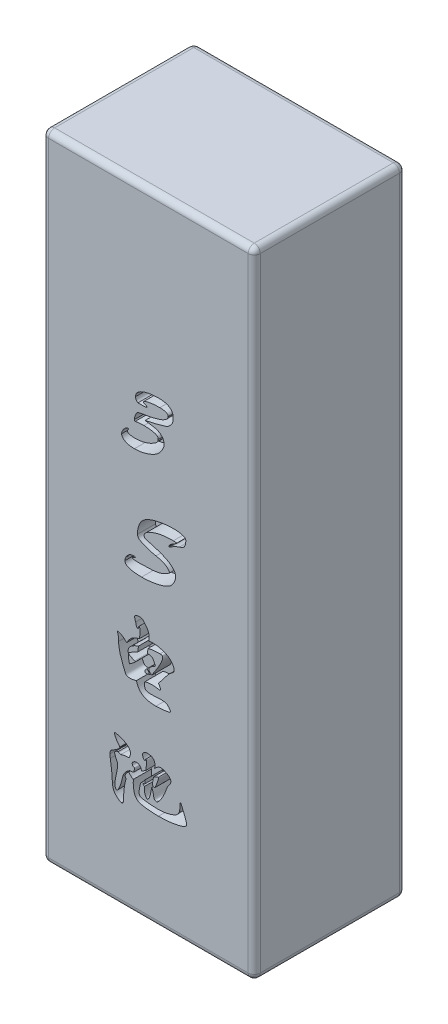
from build123d import *

# Parameters (mm, degrees)
SKETCH_1_W          = 35
SKETCH_1_H          = 25
EXTRUDE_1_DEPTH     = 105
CUT_EXTRUDE_1_DEPTH = 3
FILLET_1_R          = 1


with BuildPart() as part:
    # 草图1 → 凸台-拉伸1 (new body)
    with BuildSketch(Plane(origin=(0, 0, 0), x_dir=(1, 0, 0), z_dir=(0, 1, 0))):
        Rectangle(SKETCH_1_W, SKETCH_1_H)
    extrude(amount=EXTRUDE_1_DEPTH)

    # 草图2 → 切除-拉伸1 (cut)
    # profile 1 of 4: a face of its own
    with BuildSketch(Plane.XY.offset(12.5)):
        with BuildLine():
            add(Edge.make_bspline(
                [(-1.730306457, 73.513618816), (-1.791180014, 73.548812902), (-1.909380951, 73.61715085), (-2.039109334, 73.779414632), (-2.117631226, 73.977221056), (-2.125929828, 74.121433221), (-2.130306457, 74.197489784)],
                knots=[0, 0, 0, 0, 0.999955246, 1.941658306, 2.91444391, 4, 4, 4, 4], degree=3))
            add(Edge.make_bspline(
                [(-2.130306457, 74.197489784), (-2.127029901, 74.261627679), (-2.12051476, 74.38916019), (-2.067064093, 74.574231653), (-1.978296008, 74.747588152), (-1.85611176, 74.91048108), (-1.697984979, 75.060540823), (-1.509840803, 75.204572652), (-1.282995023, 75.331386124), (-1.027155916, 75.450909946), (-0.744482998, 75.555860885), (-0.443740206, 75.652201463), (-0.123735095, 75.726810348), (0.211255109, 75.79589898), (0.564269732, 75.842893121), (0.93353438, 75.880416215), (1.320332552, 75.901882804), (1.584363695, 75.9039575), (1.719155909, 75.905016666)],
                knots=[0, 0, 0, 0, 0.672198839, 1.336607732, 2.002717842, 2.706822371, 3.462221912, 4.28368772, 5.186885133, 6.18303703, 7.244851317, 8.348784579, 9.494572634, 10.691023334, 11.936781137, 13.229464089, 14.585596135, 16, 16, 16, 16], degree=3))
            add(Edge.make_bspline(
                [(1.719155909, 75.905016666), (1.815234647, 75.903761521), (2.001863562, 75.901323454), (2.272789741, 75.883047144), (2.525120829, 75.847159687), (2.759492676, 75.804679611), (2.974170874, 75.743283203), (3.170791952, 75.670566204), (3.349920224, 75.585067253), (3.510343267, 75.485940782), (3.651520922, 75.373641261), (3.773777431, 75.247179499), (3.877343975, 75.106997129), (3.96200843, 74.952937206), (4.026164985, 74.785499806), (4.073787162, 74.606138724), (4.102113975, 74.413446913), (4.1048478, 74.280740118), (4.106252683, 74.212543548)],
                knots=[0, 0, 0, 0, 1.385406795, 2.691094532, 3.911693398, 5.05906555, 6.122496103, 7.126604688, 8.078944564, 8.979565011, 9.839962201, 10.673298656, 11.508492024, 12.345793421, 13.199959379, 14.087495055, 15.017184635, 16, 16, 16, 16], degree=3))
            add(Edge.make_bspline(
                [(4.106252683, 74.212543548), (4.105291045, 74.150103238), (4.103416863, 74.028410351), (4.080935158, 73.852250541), (4.047498207, 73.686987867), (3.99754602, 73.533702772), (3.934112316, 73.390047516), (3.85873732, 73.253363423), (3.767784549, 73.123721718), (3.630268481, 72.965495472), (3.445329242, 72.793349144), (3.270333093, 72.651627664), (3.136743574, 72.573194525), (3.046596154, 72.532444852), (2.936832484, 72.48295041), (2.802697012, 72.43921244), (2.650060064, 72.382609116), (2.47402615, 72.329247462), (2.27768665, 72.267123926), (2.05830056, 72.206518885), (1.816660542, 72.138135381), (1.550709568, 72.071262811), (1.261683426, 71.996535214), (0.947265937, 71.922274552), (0.608163031, 71.842866372), (0.244972483, 71.758589476), (-0.142164911, 71.672683793), (-0.408400428, 71.615931983), (-0.54536022, 71.586737096)],
                knots=[0, 0, 0, 0, 0.836456046, 1.630208961, 2.376479833, 3.093602454, 3.786297661, 4.478792908, 5.182529622, 5.904783775, 7.284464382, 8.566320335, 8.910763354, 9.357749901, 9.891445239, 10.523579676, 11.246855767, 12.07342966, 12.988279315, 14.007212142, 15.123851981, 16.35436935, 17.682738842, 19.125360386, 20.684611252, 22.351164436, 24.122926027, 26, 26, 26, 26], degree=3))
            add(Edge.make_bspline(
                [(-0.54536022, 71.586737096), (-0.389667257, 71.571444628), (-0.09200559, 71.542207716), (0.331833401, 71.481612461), (0.713539777, 71.413191994), (1.053142566, 71.338038735), (1.350656799, 71.249559831), (1.606114408, 71.152813202), (1.820220296, 71.045604006), (1.994692263, 70.927541914), (2.135446583, 70.79952484), (2.257661804, 70.669792623), (2.361722104, 70.534205129), (2.446617341, 70.39140508), (2.510703762, 70.242032793), (2.559169906, 70.08813705), (2.587797441, 69.928311807), (2.590775559, 69.819824157), (2.592274188, 69.76523172)],
                knots=[0, 0, 0, 0, 1.875842043, 3.586329504, 5.132537692, 6.525559935, 7.754858419, 8.851583743, 9.797331124, 10.619928457, 11.36879248, 12.074316378, 12.755161505, 13.414166241, 14.060947262, 14.69991191, 15.345778268, 16, 16, 16, 16], degree=3))
            add(Edge.make_bspline(
                [(2.592274188, 69.76523172), (2.590780273, 69.709907826), (2.587754232, 69.597845017), (2.557266705, 69.4288221), (2.512485918, 69.255827586), (2.447480436, 69.079458475), (2.362736264, 68.90103531), (2.260675736, 68.719736543), (2.141843932, 68.534266572), (2.005896713, 68.345981103), (1.848976807, 68.161462408), (1.672326326, 67.983254436), (1.47084072, 67.819000149), (1.250126738, 67.661286235), (1.009929005, 67.511187901), (0.748160638, 67.370135946), (0.463517544, 67.24338575), (0.063023974, 67.080167636), (-0.452898853, 66.913623784), (-1.075359586, 66.765598195), (-1.694754731, 66.676473311), (-2.106374758, 66.663935955), (-2.310951618, 66.657704838)],
                knots=[0, 0, 0, 0, 0.523865779, 1.061130489, 1.623088537, 2.216335527, 2.83941307, 3.493396601, 4.186980173, 4.926278888, 5.69270977, 6.480613127, 7.300951587, 8.153167955, 9.050528849, 9.9837488, 10.968897468, 12.002210523, 14.08204034, 16.099212387, 18.061292385, 20, 20, 20, 20], degree=3))
            add(Edge.make_bspline(
                [(-2.310951618, 66.657704838), (-2.391268483, 66.658272517), (-2.547752948, 66.659378547), (-2.775157627, 66.675352732), (-2.989243287, 66.697964516), (-3.19036557, 66.732491794), (-3.378489983, 66.777303087), (-3.553236016, 66.830737482), (-3.714537856, 66.893465689), (-3.861245569, 66.965578528), (-3.99357117, 67.045617519), (-4.109417081, 67.13054801), (-4.207694193, 67.220861257), (-4.285903352, 67.317335185), (-4.349394311, 67.416322313), (-4.395618318, 67.520429801), (-4.42230651, 67.630561234), (-4.425471806, 67.705590669), (-4.42708065, 67.743726343)],
                knots=[0, 0, 0, 0, 1.478588714, 2.880791784, 4.195591928, 5.441187609, 6.63536673, 7.754298844, 8.803395663, 9.818734309, 10.7604483, 11.647475829, 12.45997408, 13.210379233, 13.928150046, 14.61971234, 15.298432668, 16, 16, 16, 16], degree=3))
            add(Edge.make_bspline(
                [(-4.42708065, 67.743726343), (-4.422003475, 67.810211763), (-4.411381293, 67.949308823), (-4.336154657, 68.158477442), (-4.219783029, 68.375999084), (-4.063733443, 68.588882517), (-3.896510857, 68.784305366), (-3.728346232, 68.928711013), (-3.574296981, 69.031574022), (-3.466887056, 69.045139433), (-3.4184785, 69.051253225)],
                knots=[0, 0, 0, 0, 0.911131539, 1.90621821, 3.019149988, 4.288022676, 5.521145276, 6.532282378, 7.338514662, 8, 8, 8, 8], degree=3))
            add(Edge.make_bspline(
                [(-3.4184785, 69.051253225), (-3.403256859, 69.050209943), (-3.374862659, 69.048263823), (-3.335861367, 69.028494014), (-3.316091558, 68.989492722), (-3.314145438, 68.961098522), (-3.313102156, 68.945876881)],
                knots=[0, 0, 0, 0, 1.072165494, 2, 2.927834506, 4, 4, 4, 4], degree=3))
            add(Edge.make_bspline(
                [(-3.313102156, 68.945876881), (-3.317793769, 68.919304062), (-3.328517105, 68.85856818), (-3.366823932, 68.809843151), (-3.388370973, 68.782436021)],
                knots=[0, 0, 0, 0, 0.875028685, 2, 2, 2, 2], degree=3))
            add(Edge.make_bspline(
                [(-3.388370973, 68.782436021), (-3.409959904, 68.755773217), (-3.449087646, 68.707449598), (-3.45913577, 68.646372609), (-3.46363979, 68.618995161)],
                knots=[0, 0, 0, 0, 1.103510232, 2, 2, 2, 2], degree=3))
            add(Edge.make_bspline(
                [(-3.46363979, 68.618995161), (-3.459091625, 68.589163433), (-3.449374206, 68.525426208), (-3.372327749, 68.444529424), (-3.260361092, 68.376118538), (-3.107886891, 68.315283188), (-2.920364443, 68.265165764), (-2.699742906, 68.23065659), (-2.449866021, 68.205790437), (-2.273032108, 68.204579862), (-2.179768822, 68.203941397)],
                knots=[0, 0, 0, 0, 0.495429141, 1.058513229, 1.788424836, 2.698863852, 3.794884536, 5.0374145, 6.437514308, 8, 8, 8, 8], degree=3))
            add(Edge.make_bspline(
                [(-2.179768822, 68.203941397), (-2.067164163, 68.205413357), (-1.842320667, 68.208352493), (-1.507817057, 68.237649482), (-1.177664346, 68.282777275), (-0.852067666, 68.344464278), (-0.530972311, 68.427669204), (-0.212845078, 68.525024835), (0.099371447, 68.644984105), (0.402288795, 68.777052128), (0.682296817, 68.921826572), (0.934057633, 69.063464966), (1.144671705, 69.210105376), (1.320406369, 69.353276109), (1.455343001, 69.499711624), (1.553398214, 69.646207567), (1.616500957, 69.794049905), (1.624832276, 69.895166079), (1.628833328, 69.943726343)],
                knots=[0, 0, 0, 0, 1.218753128, 2.433546845, 3.631995342, 4.825206456, 6.018493273, 7.221205386, 8.424668334, 9.637303694, 10.796492467, 11.836046134, 12.761696787, 13.57148077, 14.285591581, 14.907622181, 15.475393964, 16, 16, 16, 16], degree=3))
            add(Edge.make_bspline(
                [(1.628833328, 69.943726343), (1.626486935, 69.979718629), (1.621908444, 70.049949974), (1.594049447, 70.151930252), (1.542030698, 70.243683559), (1.473234545, 70.328633579), (1.381798167, 70.401936314), (1.273187608, 70.468369742), (1.146156607, 70.529175112), (0.998738173, 70.57674731), (0.835426824, 70.618946198), (0.65628536, 70.658282496), (0.461659772, 70.68972408), (0.251370177, 70.715061069), (0.026987292, 70.736817327), (-0.213291269, 70.751575952), (-0.468591019, 70.76025184), (-0.644277752, 70.760700146), (-0.734607532, 70.760930644)],
                knots=[0, 0, 0, 0, 0.637672052, 1.24428237, 1.851953661, 2.492146166, 3.168067819, 3.914632588, 4.743387679, 5.654342341, 6.651629748, 7.729396191, 8.899782899, 10.140110992, 11.478605832, 12.890010473, 14.400990979, 16, 16, 16, 16], degree=3))
            add(Edge.make_bspline(
                [(-0.734607532, 70.760930644), (-0.876600867, 70.759633026), (-1.147988868, 70.757152925), (-1.535687891, 70.728968387), (-1.885259597, 70.684173928), (-2.102628285, 70.635565), (-2.205575274, 70.612543548)],
                knots=[0, 0, 0, 0, 1.14957966, 2.197160359, 3.146165375, 4, 4, 4, 4], degree=3))
            add(Edge.make_bspline(
                [(-2.205575274, 70.612543548), (-2.221537499, 70.615950054), (-2.255411473, 70.623179115), (-2.29274014, 70.67329526), (-2.307855197, 70.746997569), (-2.309829089, 70.80386158), (-2.310951618, 70.836199462)],
                knots=[0, 0, 0, 0, 0.701166991, 1.487969987, 2.571438647, 4, 4, 4, 4], degree=3))
            add(Edge.make_bspline(
                [(-2.310951618, 70.836199462), (-2.308679759, 70.892249801), (-2.30389905, 71.010197385), (-2.269233978, 71.191421986), (-2.217301135, 71.385956611), (-2.144324169, 71.582637428), (-2.061438846, 71.768762803), (-1.967597585, 71.922649117), (-1.869433391, 72.040473451), (-1.749120502, 72.120718391), (-1.591567652, 72.174180551), (-1.380138812, 72.224930696), (-1.102856018, 72.283727704), (-0.894655016, 72.316848176), (-0.779768822, 72.335124193)],
                knots=[0, 0, 0, 0, 0.826634098, 1.739498749, 2.714400975, 3.795086418, 4.831442747, 5.714853365, 6.449116581, 7.073916504, 7.820342101, 8.889999852, 10.283888761, 12, 12, 12, 12], degree=3))
            add(Edge.make_bspline(
                [(-0.779768822, 72.335124193), (-0.601859733, 72.363004726), (-0.259062524, 72.416725247), (0.234270357, 72.507138009), (0.687282583, 72.60176827), (1.100885021, 72.697153171), (1.472908848, 72.7985009), (1.805080828, 72.900367973), (2.096833216, 73.007490154), (2.350165788, 73.119482517), (2.568412753, 73.234432733), (2.757553952, 73.347093775), (2.915330498, 73.464676896), (3.047797543, 73.579092561), (3.151222603, 73.695612685), (3.224447782, 73.813929213), (3.270702679, 73.933974648), (3.277257426, 74.015764509), (3.280446231, 74.0555543)],
                knots=[0, 0, 0, 0, 1.872580607, 3.608109113, 5.214819709, 6.684847228, 8.021201173, 9.223647564, 10.296794887, 11.251218765, 12.101476762, 12.86087382, 13.537747157, 14.145039752, 14.678692822, 15.150444373, 15.586701329, 16, 16, 16, 16], degree=3))
            add(Edge.make_bspline(
                [(3.280446231, 74.0555543), (3.275563692, 74.098709683), (3.265686049, 74.186015378), (3.19162864, 74.307571349), (3.069226501, 74.405163474), (2.90695767, 74.487744547), (2.70567631, 74.555490268), (2.465212248, 74.60374734), (2.186390598, 74.629724601), (1.988026337, 74.633952405), (1.882596769, 74.636199462)],
                knots=[0, 0, 0, 0, 0.628077383, 1.270634851, 2.012989815, 2.888371059, 3.917623474, 5.103918923, 6.460748047, 8, 8, 8, 8], degree=3))
            add(Edge.make_bspline(
                [(1.882596769, 74.636199462), (1.705482879, 74.634289546), (1.363128614, 74.630597753), (0.867883768, 74.59805216), (0.409686294, 74.545672988), (0.055200015, 74.482664691), (-0.200479054, 74.423740469), (-0.363525371, 74.381589217), (-0.50218794, 74.338687376), (-0.615834751, 74.296457929), (-0.70649058, 74.255010235), (-0.768836615, 74.210210521), (-0.813139217, 74.165992672), (-0.819768704, 74.131455071), (-0.822779575, 74.115769354)],
                knots=[0, 0, 0, 0, 2.261010845, 4.3704461, 6.333206645, 8.146368439, 8.963362016, 9.682596285, 10.296259202, 10.814702885, 11.232199318, 11.559887471, 11.800116973, 12, 12, 12, 12], degree=3))
            add(Edge.make_bspline(
                [(-0.822779575, 74.115769354), (-0.818084736, 74.086793577), (-0.808253838, 74.026118882), (-0.750272499, 73.961426887), (-0.678644188, 73.916398414), (-0.592609311, 73.879634418), (-0.480752058, 73.833415994), (-0.395056587, 73.804777135), (-0.347510758, 73.788887634)],
                knots=[0, 0, 0, 0, 0.849706339, 1.779268026, 2.43487114, 3.34138727, 4.524940175, 6, 6, 6, 6], degree=3))
            add(Edge.make_bspline(
                [(-0.347510758, 73.788887634), (-0.331797035, 73.786678622), (-0.297439357, 73.781848671), (-0.258623366, 73.743561534), (-0.221065371, 73.703317607), (-0.216350146, 73.66767632), (-0.214177425, 73.651253225)],
                knots=[0, 0, 0, 0, 0.89795082, 1.963347926, 3.061534127, 4, 4, 4, 4], degree=3))
            add(Edge.make_bspline(
                [(-0.214177425, 73.651253225), (-0.221037085, 73.63791114), (-0.240040758, 73.600948866), (-0.325273451, 73.580244655), (-0.440767689, 73.556318182), (-0.608588135, 73.539125412), (-0.821693345, 73.524500263), (-1.082954908, 73.514067257), (-1.391215017, 73.510190234), (-1.612021586, 73.512422828), (-1.730306457, 73.513618816)],
                knots=[0, 0, 0, 0, 0.225272153, 0.62408317, 1.248098043, 2.11058556, 3.214749851, 4.573187907, 6.164275508, 8, 8, 8, 8], degree=3))
        make_face()
    # profile 2 of 4: a face of its own
    with BuildSketch(Plane.XY.offset(12.5)):
        with BuildLine():
            add(Edge.make_bspline(
                [(3.555715048, 51.813618816), (3.507301888, 51.893539111), (3.409344397, 52.055247032), (3.212970439, 52.26896207), (2.979890167, 52.461270995), (2.709513095, 52.634009864), (2.398950786, 52.781688835), (2.050509994, 52.907022281), (1.665005718, 53.016184842), (1.392083358, 53.065451233), (1.250338704, 53.091038171)],
                knots=[0, 0, 0, 0, 0.820907435, 1.660995296, 2.539275621, 3.475815558, 4.477785669, 5.559859216, 6.732691188, 8, 8, 8, 8], degree=3))
            add(Edge.make_bspline(
                [(1.250338704, 53.091038171), (1.085016281, 53.121973365), (0.759510197, 53.182882184), (0.286542241, 53.307852063), (-0.166383531, 53.448430165), (-0.525347023, 53.584933421), (-0.792858583, 53.700462106), (-0.971665264, 53.781662943), (-1.129703053, 53.860036875), (-1.268655903, 53.93206848), (-1.388391068, 53.999783235), (-1.484399711, 54.067543197), (-1.564348095, 54.126656827), (-1.6393694, 54.202306471), (-1.708504267, 54.297437593), (-1.766010846, 54.414240206), (-1.806855032, 54.532084922), (-1.810317237, 54.612579801), (-1.812026887, 54.652328494)],
                knots=[0, 0, 0, 0, 2.231390021, 4.393421135, 6.487556548, 8.522957162, 9.486057926, 10.354481635, 11.128807778, 11.826658411, 12.432006073, 12.951853481, 13.385726504, 13.74897995, 14.361683441, 14.93603757, 15.474611091, 16, 16, 16, 16], degree=3))
            add(Edge.make_bspline(
                [(-1.812026887, 54.652328494), (-1.810243389, 54.7412714), (-1.806698957, 54.918031952), (-1.782378603, 55.179416399), (-1.744540304, 55.434709562), (-1.687688738, 55.682259543), (-1.617314992, 55.924088127), (-1.529082224, 56.158254538), (-1.424019461, 56.385123284), (-1.308276188, 56.608830624), (-1.162281562, 56.822015334), (-0.984679372, 57.02359926), (-0.771195512, 57.210117294), (-0.527126624, 57.387595103), (-0.248253614, 57.549868439), (0.062994794, 57.700850768), (0.408068226, 57.837043601), (0.781659023, 57.962152115), (1.175490644, 58.075331558), (1.582916023, 58.170920442), (1.997282466, 58.255083691), (2.420317194, 58.325078477), (2.851861851, 58.374535355), (3.291977399, 58.41515907), (3.740471435, 58.43541594), (4.042438285, 58.439513443), (4.194424726, 58.441575806)],
                knots=[0, 0, 0, 0, 0.796097096, 1.582122374, 2.348063635, 3.104620427, 3.853848825, 4.601123703, 5.341951547, 6.091207422, 6.852971061, 7.648576651, 8.489471317, 9.385367846, 10.346110912, 11.37352057, 12.479297411, 13.664339857, 14.899202987, 16.145880082, 17.409354384, 18.683699227, 19.982637736, 21.296750779, 22.639396249, 24, 24, 24, 24], degree=3))
            add(Edge.make_bspline(
                [(4.194424726, 58.441575806), (4.316333951, 58.440726573), (4.547462998, 58.439116503), (4.873947399, 58.4169734), (5.161731347, 58.385125524), (5.409017964, 58.334731828), (5.617770951, 58.279324478), (5.789279655, 58.222066498), (5.924070873, 58.163054321), (6.027423205, 58.100191886), (6.100360721, 58.024938589), (6.151691015, 57.93910044), (6.179425525, 57.83819173), (6.183614135, 57.767185708), (6.185822575, 57.729747849)],
                knots=[0, 0, 0, 0, 1.907925139, 3.617256357, 5.120455527, 6.43646588, 7.563359051, 8.500189904, 9.263571122, 9.864306058, 10.380121743, 10.888189608, 11.413798988, 12, 12, 12, 12], degree=3))
            add(Edge.make_bspline(
                [(6.185822575, 57.729747849), (6.184216279, 57.657977184), (6.18113879, 57.520472355), (6.15657365, 57.322733368), (6.12026452, 57.141696789), (6.0629866, 56.981448765), (6.000329655, 56.841583604), (5.928809299, 56.725863742), (5.852308626, 56.632812776), (5.760545618, 56.563526497), (5.647381387, 56.506165462), (5.505787947, 56.439244487), (5.32459611, 56.364812951), (5.190273016, 56.314293402), (5.117005371, 56.286737096)],
                knots=[0, 0, 0, 0, 1.300752096, 2.492100301, 3.608643568, 4.640340446, 5.570793169, 6.382255368, 7.101220932, 7.740727149, 8.450232227, 9.397953669, 10.580692263, 12, 12, 12, 12], degree=3))
            add(Edge.make_bspline(
                [(5.117005371, 56.286737096), (5.047325762, 56.263494819), (4.916754417, 56.21994154), (4.737046632, 56.153217647), (4.58511638, 56.093688248), (4.452383889, 56.033252038), (4.316978159, 55.962532039), (4.157535611, 55.871787477), (3.96536402, 55.752585307), (3.825229649, 55.665259059), (3.749263436, 55.617919892)],
                knots=[0, 0, 0, 0, 1.153225154, 2.161007542, 3.0095779, 3.714726508, 4.449696184, 5.407397547, 6.594561858, 8, 8, 8, 8], degree=3))
            add(Edge.make_bspline(
                [(3.749263436, 55.617919892), (3.717119685, 55.597661772), (3.65834575, 55.560620375), (3.576303661, 55.512464223), (3.508742599, 55.47795174), (3.467638222, 55.461431762), (3.450338704, 55.454479031)],
                knots=[0, 0, 0, 0, 1.335970956, 2.442785003, 3.344618021, 4, 4, 4, 4], degree=3))
            add(Edge.make_bspline(
                [(3.450338704, 55.454479031), (3.429601097, 55.456282207), (3.390613443, 55.459672261), (3.381490743, 55.497150564), (3.377220425, 55.514694085)],
                knots=[0, 0, 0, 0, 1.063803838, 2, 2, 2, 2], degree=3))
            add(Edge.make_bspline(
                [(3.377220425, 55.514694085), (3.380798867, 55.539550343), (3.388943457, 55.596123573), (3.44124217, 55.680204372), (3.51479779, 55.777421538), (3.617515495, 55.885547301), (3.747999541, 55.997277742), (3.901417155, 56.110940551), (4.075755429, 56.225954773), (4.20318463, 56.295566206), (4.269693543, 56.331898386)],
                knots=[0, 0, 0, 0, 0.481016015, 1.094799946, 1.876333894, 2.846811501, 3.966565452, 5.194289722, 6.535620247, 8, 8, 8, 8], degree=3))
            add(Edge.make_bspline(
                [(4.269693543, 56.331898386), (4.328131453, 56.363813996), (4.430158358, 56.419535546), (4.556010624, 56.494645783), (4.639689547, 56.55325945), (4.661895463, 56.597931334), (4.669693543, 56.613618816)],
                knots=[0, 0, 0, 0, 1.606940928, 2.805562504, 3.580547871, 4, 4, 4, 4], degree=3))
            add(Edge.make_bspline(
                [(4.669693543, 56.613618816), (4.66736021, 56.619822221), (4.661402691, 56.635660895), (4.630003908, 56.648436454), (4.587584517, 56.661016939), (4.526457735, 56.670958409), (4.449822331, 56.678989154), (4.355816253, 56.686065835), (4.244597032, 56.686487598), (4.164314192, 56.688050424), (4.121306446, 56.688887634)],
                knots=[0, 0, 0, 0, 0.271548451, 0.693323603, 1.327259845, 2.190788188, 3.2904756, 4.599130666, 6.178144631, 8, 8, 8, 8], degree=3))
            add(Edge.make_bspline(
                [(4.121306446, 56.688887634), (3.959275892, 56.687071744), (3.64077604, 56.683502291), (3.171525248, 56.660265972), (2.719758185, 56.618596768), (2.284402701, 56.564896625), (1.86752981, 56.487463437), (1.466439133, 56.401088271), (1.083000191, 56.295670649), (0.72246195, 56.174287521), (0.391710187, 56.04552974), (0.101394773, 55.910746321), (-0.146462107, 55.774723881), (-0.348091409, 55.632301505), (-0.509501381, 55.489162927), (-0.624049323, 55.339352996), (-0.698393869, 55.184170328), (-0.706838618, 55.076709915), (-0.710951618, 55.024371505)],
                knots=[0, 0, 0, 0, 1.443500069, 2.837455931, 4.184029143, 5.484677003, 6.743594713, 7.959937656, 9.13895992, 10.284008972, 11.34776136, 12.299150409, 13.134054904, 13.862330128, 14.495108856, 15.046875272, 15.535782229, 16, 16, 16, 16], degree=3))
            add(Edge.make_bspline(
                [(-0.710951618, 55.024371505), (-0.706275841, 54.984181745), (-0.696586375, 54.900897768), (-0.633604013, 54.790231052), (-0.550208489, 54.697411823), (-0.476539185, 54.666680517), (-0.442134414, 54.652328494)],
                knots=[0, 0, 0, 0, 0.989554999, 2.050623775, 3.089609401, 4, 4, 4, 4], degree=3))
            Line((-0.442134414, 54.652328494), (1.222381715, 54.162005913))
            add(Edge.make_bspline(
                [(1.222381715, 54.162005913), (1.358088417, 54.121164272), (1.623604817, 54.041255723), (2.010782291, 53.911163222), (2.374664714, 53.765805171), (2.718136372, 53.617887678), (3.031011099, 53.460759868), (3.314485748, 53.308076501), (3.560645339, 53.150778776), (3.772229146, 52.992766575), (3.955129313, 52.838627102), (4.106683192, 52.682131675), (4.232772133, 52.528822505), (4.329691133, 52.372963014), (4.400698169, 52.216227227), (4.454574205, 52.056725827), (4.484257153, 51.891428038), (4.488886006, 51.779315732), (4.491198919, 51.723296236)],
                knots=[0, 0, 0, 0, 1.569926476, 3.071633303, 4.522661867, 5.909494893, 7.212832509, 8.399869998, 9.474839758, 10.445233056, 11.323779984, 12.121206503, 12.855393202, 13.518691094, 14.147634979, 14.757851845, 15.379332052, 16, 16, 16, 16], degree=3))
            add(Edge.make_bspline(
                [(4.491198919, 51.723296236), (4.484658024, 51.614374431), (4.471159972, 51.389599051), (4.366157205, 51.052452363), (4.2038508, 50.707168569), (4.020217489, 50.418765894), (3.83423808, 50.189619353), (3.657415583, 50.025299461), (3.4488934, 49.873515398), (3.211316044, 49.728612644), (2.941561198, 49.59639641), (2.640787739, 49.474230156), (2.3099067, 49.360471366), (1.827014105, 49.224676821), (1.199099008, 49.08299408), (0.430465074, 48.961107526), (-0.346561641, 48.881901562), (-0.868467101, 48.873665045), (-1.130306457, 48.869532795)],
                knots=[0, 0, 0, 0, 0.752754734, 1.553414692, 2.42340864, 3.389424232, 3.910889496, 4.461886233, 5.054208856, 5.693140428, 6.385315681, 7.130579478, 7.938506143, 8.805255288, 10.600794157, 12.389302065, 14.188517088, 16, 16, 16, 16], degree=3))
            add(Edge.make_bspline(
                [(-1.130306457, 48.869532795), (-1.234972894, 48.870518736), (-1.438626249, 48.872437118), (-1.735575094, 48.882653363), (-2.01531501, 48.901880687), (-2.277974821, 48.929236679), (-2.523100212, 48.966458936), (-2.75109762, 49.007759011), (-2.96087313, 49.060851145), (-3.153658417, 49.116473537), (-3.325836279, 49.1836848), (-3.476742492, 49.254900846), (-3.603614333, 49.335500547), (-3.708298039, 49.421650162), (-3.792038362, 49.514271573), (-3.851542099, 49.615012244), (-3.888228507, 49.722955749), (-3.891899534, 49.797568467), (-3.893747317, 49.835124193)],
                knots=[0, 0, 0, 0, 1.596291473, 3.105963309, 4.530587204, 5.871900175, 7.131983815, 8.311273364, 9.403700874, 10.430946621, 11.368912419, 12.219681164, 12.971800659, 13.654883692, 14.282240274, 14.86536268, 15.428889215, 16, 16, 16, 16], degree=3))
            add(Edge.make_bspline(
                [(-3.893747317, 49.835124193), (-3.888539101, 49.911019899), (-3.877704829, 50.068900201), (-3.791281459, 50.304647345), (-3.653926483, 50.542471735), (-3.505346121, 50.737741267), (-3.365258695, 50.887400874), (-3.252453566, 50.987750602), (-3.13477822, 51.073662606), (-3.012269982, 51.141777995), (-2.885835814, 51.197002794), (-2.755179392, 51.235756957), (-2.619181369, 51.257277206), (-2.527511089, 51.261123256), (-2.480844091, 51.263081182)],
                knots=[0, 0, 0, 0, 1.245188875, 2.590275593, 4.07801453, 5.75113495, 6.609623385, 7.444252278, 8.229077228, 8.9992613, 9.743410647, 10.492765198, 11.232705257, 12, 12, 12, 12], degree=3))
            add(Edge.make_bspline(
                [(-2.480844091, 51.263081182), (-2.425845546, 51.263159459), (-2.331455761, 51.2632938), (-2.218354286, 51.246638032), (-2.135577303, 51.233186235), (-2.115812152, 51.199693035), (-2.108801081, 51.187812365)],
                knots=[0, 0, 0, 0, 1.662530897, 2.853274219, 3.593234739, 4, 4, 4, 4], degree=3))
            add(Edge.make_bspline(
                [(-2.108801081, 51.187812365), (-2.111975689, 51.181659671), (-2.121327759, 51.163534467), (-2.161677469, 51.148930836), (-2.215716762, 51.123859563), (-2.261148929, 51.108487268), (-2.287295704, 51.099640322)],
                knots=[0, 0, 0, 0, 0.400177156, 1.178880859, 2.376410993, 4, 4, 4, 4], degree=3))
            add(Edge.make_bspline(
                [(-2.287295704, 51.099640322), (-2.326186742, 51.084265875), (-2.396432737, 51.056496152), (-2.488208552, 51.014077602), (-2.560403935, 50.984546606), (-2.621075462, 50.95729407), (-2.678399189, 50.917618624), (-2.685777893, 50.869699865), (-2.689446242, 50.845876881)],
                knots=[0, 0, 0, 0, 1.510662587, 2.728597701, 3.65730654, 4.317824595, 5.163700428, 6, 6, 6, 6], degree=3))
            add(Edge.make_bspline(
                [(-2.689446242, 50.845876881), (-2.68400887, 50.833401481), (-2.669299204, 50.799651913), (-2.596202838, 50.776593154), (-2.49805759, 50.751017486), (-2.355599844, 50.730646219), (-2.175017105, 50.717863005), (-1.954105227, 50.703745899), (-1.693064154, 50.698806129), (-1.505936923, 50.697949317), (-1.405575274, 50.697489784)],
                knots=[0, 0, 0, 0, 0.239795111, 0.648715167, 1.282346052, 2.141396028, 3.242446976, 4.590162425, 6.171207263, 8, 8, 8, 8], degree=3))
            add(Edge.make_bspline(
                [(-1.405575274, 50.697489784), (-1.27152542, 50.698101176), (-1.012738228, 50.699281487), (-0.637783294, 50.702699915), (-0.290133347, 50.712134171), (0.03111357, 50.721687407), (0.325685577, 50.737639097), (0.593975914, 50.753470955), (0.834781435, 50.775598403), (1.116645058, 50.805639936), (1.439985858, 50.859059061), (1.805566201, 50.936195877), (2.145023348, 51.03629371), (2.46168095, 51.152275118), (2.75832137, 51.288883133), (3.038960884, 51.444729847), (3.306278587, 51.617888291), (3.472777942, 51.748538822), (3.555715048, 51.813618816)],
                knots=[0, 0, 0, 0, 1.237555253, 2.389136853, 3.461554972, 4.448169342, 5.355997217, 6.184920643, 6.92906814, 7.588266918, 8.801374579, 9.952746989, 11.035427716, 12.065603678, 13.063517212, 14.046974835, 15.027153848, 16, 16, 16, 16], degree=3))
        make_face()
    # profile 3 of 4: a face of its own
    with BuildSketch(Plane.XY.offset(12.5)):
        with BuildLine():
            add(Edge.make_bspline(
                [(0.09980107, 40.279210214), (0.144644114, 40.294147049), (0.247412693, 40.328378385), (0.431172267, 40.351367544), (0.658549769, 40.367732783), (0.932279017, 40.376041785), (1.250689974, 40.356184484), (1.610358571, 40.298479523), (2.00992794, 40.201056474), (2.363340184, 40.094341456), (2.653772635, 39.992029202), (2.863351919, 39.90661244), (3.056746424, 39.811475043), (3.236524874, 39.710991079), (3.399949247, 39.60095217), (3.548848799, 39.484708518), (3.683872467, 39.362106341), (3.835414778, 39.191000251), (3.995133388, 38.979965179), (4.138417447, 38.726398204), (4.229940287, 38.480318567), (4.242299715, 38.316431413), (4.248188167, 38.238349999)],
                knots=[0, 0, 0, 0, 0.553780623, 1.269120991, 2.163729509, 3.232830331, 4.480664985, 5.903029542, 7.503376039, 9.305785439, 10.234765888, 11.117780202, 11.960870582, 12.763595554, 13.533856831, 14.271233816, 14.980009463, 15.671230546, 16.952115016, 18.078508404, 19.084536065, 20, 20, 20, 20], degree=3))
            add(Edge.make_bspline(
                [(4.248188167, 38.238349999), (4.245583426, 38.19296852), (4.240621105, 38.106511763), (4.206288951, 37.983352718), (4.143380952, 37.877916326), (4.084055553, 37.824149438), (4.05463978, 37.797489784)],
                knots=[0, 0, 0, 0, 1.092064677, 2.080504456, 3.048241631, 4, 4, 4, 4], degree=3))
            add(Edge.make_bspline(
                [(4.05463978, 37.797489784), (3.970649976, 37.733276698), (3.807935778, 37.60887611), (3.584022666, 37.410407407), (3.379416433, 37.217426989), (3.222805361, 37.046152504), (3.09134937, 36.891610499), (2.970018543, 36.738011141), (2.819090762, 36.549646801), (2.642651122, 36.322621343), (2.438741172, 36.059071284), (2.208961678, 35.757193059), (1.95060225, 35.420330413), (1.770629608, 35.182542124), (1.676145156, 35.057704838)],
                knots=[0, 0, 0, 0, 1.044716322, 2.023938297, 2.956112171, 3.82364298, 4.316308196, 4.961480688, 5.758265085, 6.70229449, 7.803562713, 9.052159997, 10.452403401, 12, 12, 12, 12], degree=3))
            add(Edge.make_bspline(
                [(1.676145156, 35.057704838), (1.7219572, 34.981381283), (1.80440491, 34.844022156), (1.906087467, 34.655627673), (1.968184893, 34.504429091), (1.992150472, 34.387732767), (1.984574893, 34.298811064), (1.944246865, 34.236385935), (1.879290117, 34.198868176), (1.757864332, 34.191527879), (1.57443673, 34.209214993), (1.368402517, 34.24869903), (1.170387669, 34.287765288), (0.98542794, 34.305105753), (0.771610541, 34.314803063), (0.531304052, 34.320383625), (0.268729669, 34.310939908), (-0.010100811, 34.274989328), (-0.302401944, 34.21688531), (-0.499785745, 34.162887925), (-0.601274199, 34.135124193)],
                knots=[0, 0, 0, 0, 1.380750272, 2.484929504, 3.319218933, 3.906050837, 4.321227089, 4.666660844, 5.015655865, 5.441854461, 6.523290334, 7.877957796, 8.691536812, 9.653071169, 10.755345, 12.012091177, 13.380969223, 14.826428693, 16.36825088, 18, 18, 18, 18], degree=3))
            add(Edge.make_bspline(
                [(-0.601274199, 34.135124193), (-0.609690799, 34.052043523), (-0.624978257, 33.901140282), (-0.627912438, 33.74951006), (-0.629231188, 33.681360752)],
                knots=[0, 0, 0, 0, 1.101111799, 2, 2, 2, 2], degree=3))
            add(Edge.make_bspline(
                [(-0.629231188, 33.681360752), (-0.627274864, 33.60500016), (-0.623683782, 33.464830616), (-0.57575524, 33.275584125), (-0.502631879, 33.122797386), (-0.384795896, 33.01295724), (-0.227069825, 32.945532857), (-0.030312423, 32.897868051), (0.213008535, 32.869661574), (0.390767327, 32.866088656), (0.486897844, 32.864156451)],
                knots=[0, 0, 0, 0, 1.125302992, 2.065636258, 2.866371255, 3.593285261, 4.38938235, 5.373391023, 6.579551108, 8, 8, 8, 8], degree=3))
            Line((0.486897844, 32.864156451), (2.108403221, 32.939425268))
            add(Edge.make_bspline(
                [(2.108403221, 32.939425268), (2.183729938, 32.939187656), (2.326008853, 32.938738848), (2.526144999, 32.920018667), (2.701617618, 32.89693962), (2.856057006, 32.856650029), (3.000044139, 32.801023311), (3.134809174, 32.710519912), (3.268730295, 32.5937411), (3.391406755, 32.4529964), (3.499085555, 32.314332994), (3.584539049, 32.194841382), (3.63244707, 32.098377694), (3.65756958, 32.022664012), (3.646320874, 31.962696435), (3.621485738, 31.911648952), (3.576857828, 31.869259736), (3.526098824, 31.840153914), (3.471334425, 31.818349546), (3.410366924, 31.802515738), (3.332614017, 31.782154935), (3.235355843, 31.764063944), (3.119978622, 31.742452891), (2.986586277, 31.719085374), (2.835560581, 31.69254685), (2.491007866, 31.641189754), (1.954903855, 31.576598004), (1.472807894, 31.56759645), (1.230983866, 31.563081182)],
                knots=[0, 0, 0, 0, 1.306910492, 2.468523945, 3.487530944, 4.374938771, 5.234601293, 6.152800332, 7.175978169, 8.312796182, 9.385697657, 10.2278885, 10.851232964, 11.261713174, 11.576782984, 11.88287744, 12.234861316, 12.625428626, 12.89349156, 13.255881141, 13.717671377, 14.288764538, 14.972193603, 15.755802524, 16.639625557, 17.634018942, 21.803542446, 26, 26, 26, 26], degree=3))
            add(Edge.make_bspline(
                [(1.230983866, 31.563081182), (1.109774908, 31.564531096), (0.87495179, 31.567340074), (0.534865292, 31.594604385), (0.218191802, 31.632565296), (-0.073689185, 31.694623106), (-0.342808572, 31.767589585), (-0.586580033, 31.86055401), (-0.807482471, 31.968027923), (-1.003612616, 32.0956981), (-1.179682237, 32.239795999), (-1.33897372, 32.397233188), (-1.483676346, 32.567761936), (-1.613505673, 32.751783303), (-1.728451285, 32.949949742), (-1.823397405, 33.164451421), (-1.909555794, 33.389733568), (-1.95043552, 33.54755967), (-1.971166672, 33.627597311)],
                knots=[0, 0, 0, 0, 1.391550044, 2.69590734, 3.916035752, 5.050968551, 6.119507765, 7.114763045, 8.042467133, 8.935219683, 9.795306254, 10.650969539, 11.503657974, 12.360112807, 13.234110458, 14.129288559, 15.051314528, 16, 16, 16, 16], degree=3))
            add(Edge.make_bspline(
                [(-1.971166672, 33.627597311), (-2.064651199, 33.597419144), (-2.244232677, 33.539447626), (-2.509203861, 33.480030119), (-2.756350622, 33.441368831), (-2.98397838, 33.429174538), (-3.186880208, 33.434195951), (-3.360370621, 33.456950717), (-3.501418016, 33.493625163), (-3.609768987, 33.534817055), (-3.681122928, 33.611115195), (-3.743356079, 33.70761872), (-3.817859996, 33.846193194), (-3.902829485, 34.027834433), (-4.000932187, 34.25118655), (-4.113820399, 34.51645326), (-4.23514045, 34.825988698), (-4.365094836, 35.169049596), (-4.494118303, 35.527299848), (-4.608785934, 35.883445988), (-4.702230562, 36.228470106), (-4.783988156, 36.559094263), (-4.843042464, 36.878937647), (-4.889804756, 37.185635196), (-4.916295756, 37.481604029), (-4.919925982, 37.674862192), (-4.921704306, 37.769532795)],
                knots=[0, 0, 0, 0, 1.149240449, 2.207662655, 3.174745525, 4.073929196, 4.871414988, 5.5489629, 6.112683219, 6.585607399, 6.870387179, 7.317210698, 7.929250324, 8.70987367, 9.664021703, 10.784478502, 12.083908154, 13.554983249, 15.078298145, 16.540372819, 17.932674469, 19.261567318, 20.525375079, 21.7380716, 22.89195818, 24, 24, 24, 24], degree=3))
            add(Edge.make_bspline(
                [(-4.921704306, 37.769532795), (-4.922915601, 37.872074794), (-4.925153849, 38.061553404), (-4.941588284, 38.32366418), (-4.968790407, 38.541500146), (-5.013044845, 38.71593945), (-5.059821854, 38.852634811), (-5.090448903, 38.961470119), (-5.107080312, 39.044085454), (-5.119660426, 39.10967324), (-5.102815448, 39.180824918), (-5.0254582, 39.193915107), (-4.94372573, 39.172919248), (-4.832328353, 39.126439358), (-4.674835444, 39.058117182), (-4.478623899, 38.962114985), (-4.257328324, 38.838047173), (-4.035950947, 38.66997019), (-3.818056882, 38.466456665), (-3.682389491, 38.312003864), (-3.612026887, 38.231898386)],
                knots=[0, 0, 0, 0, 1.714520076, 3.16811535, 4.390379319, 5.37885376, 6.171176299, 6.805129531, 7.270620928, 7.572446211, 7.940156515, 8.327097602, 8.705591225, 9.373430328, 10.328863719, 11.583326282, 13.022566792, 14.564098569, 16.21800236, 18, 18, 18, 18], degree=3))
            add(Edge.make_bspline(
                [(-3.612026887, 38.231898386), (-3.543495287, 38.346276167), (-3.414503394, 38.561560888), (-3.206942681, 38.848271307), (-3.009459369, 39.085188334), (-2.838054764, 39.245878662), (-2.692903678, 39.352075728), (-2.569751918, 39.42912924), (-2.429184668, 39.506938816), (-2.270080908, 39.583376722), (-2.093131306, 39.661408342), (-1.897178609, 39.737304989), (-1.685211046, 39.818207272), (-1.536266143, 39.866942533), (-1.459338715, 39.89211344)],
                knots=[0, 0, 0, 0, 1.707717922, 3.214309404, 4.530362721, 5.654877944, 6.213352942, 6.832574337, 7.515051122, 8.270904371, 9.093461732, 9.992325248, 10.963071218, 12, 12, 12, 12], degree=3))
            add(Edge.make_bspline(
                [(-1.459338715, 39.89211344), (-1.450221549, 39.970913489), (-1.431189275, 40.135410238), (-1.411856352, 40.395065832), (-1.402484725, 40.678413033), (-1.398012633, 40.925800999), (-1.400324785, 41.121565484), (-1.406024572, 41.251485718), (-1.417608819, 41.361132811), (-1.428100502, 41.451464861), (-1.447188414, 41.52220415), (-1.470309802, 41.571662098), (-1.496159509, 41.609144234), (-1.520992906, 41.614412555), (-1.532456995, 41.616844623)],
                knots=[0, 0, 0, 0, 1.613720619, 3.368675535, 5.295099884, 7.380767975, 8.401728707, 9.277841715, 10.025174524, 10.64390704, 11.128690536, 11.500502505, 11.769412006, 12, 12, 12, 12], degree=3))
            add(Edge.make_bspline(
                [(-1.532456995, 41.616844623), (-1.544697982, 41.613729134), (-1.57226952, 41.606711824), (-1.600588266, 41.561878494), (-1.617047755, 41.497577537), (-1.629193427, 41.416628984), (-1.641806472, 41.335158484), (-1.6676073, 41.267002667), (-1.715020175, 41.224644498), (-1.752581027, 41.219426542), (-1.771166672, 41.216844623)],
                knots=[0, 0, 0, 0, 0.579354927, 1.30493612, 2.334418076, 3.744603853, 5.160889958, 6.238381738, 7.128326168, 8, 8, 8, 8], degree=3))
            add(Edge.make_bspline(
                [(-1.771166672, 41.216844623), (-1.789750288, 41.218768897), (-1.829181221, 41.222851844), (-1.879290654, 41.266417655), (-1.927160535, 41.324301791), (-1.966669393, 41.408778479), (-2.007922386, 41.512104718), (-2.040220756, 41.641257861), (-2.073354691, 41.791582518), (-2.089452248, 41.900576821), (-2.098048392, 41.958780107)],
                knots=[0, 0, 0, 0, 0.512685013, 1.087821071, 1.788185926, 2.624591649, 3.681423227, 4.910716466, 6.350313288, 8, 8, 8, 8], degree=3))
            add(Edge.make_bspline(
                [(-2.098048392, 41.958780107), (-2.124710407, 42.02368997), (-2.17429018, 42.144394136), (-2.230837288, 42.316735438), (-2.267014083, 42.464753022), (-2.281236584, 42.591715654), (-2.266888306, 42.703855764), (-2.209371025, 42.797964669), (-2.119434723, 42.875269831), (-1.957175884, 42.94469118), (-1.746192772, 43.012842403), (-1.570297816, 43.024327982), (-1.487295704, 43.029747849)],
                knots=[0, 0, 0, 0, 1.275020111, 2.370983895, 3.293819499, 4.039309166, 4.686169846, 5.305137666, 5.997624495, 6.807609614, 8.493560299, 10, 10, 10, 10], degree=3))
            add(Edge.make_bspline(
                [(-1.487295704, 43.029747849), (-1.414377496, 43.026664027), (-1.274365614, 43.020742713), (-1.076664518, 42.957189222), (-0.902172634, 42.855671342), (-0.706533706, 42.652522787), (-0.478139875, 42.349603136), (-0.226205565, 42.035652514), (-0.045814027, 41.733195599), (0.050016705, 41.456690866), (0.104616753, 41.140882132), (0.11132068, 40.917435913), (0.114854833, 40.799640322)],
                knots=[0, 0, 0, 0, 0.731505247, 1.404579586, 2.067722297, 2.741144488, 4.223818725, 5.888825166, 6.787197857, 7.75239781, 8.815116991, 10, 10, 10, 10], degree=3))
            add(Edge.make_bspline(
                [(0.114854833, 40.799640322), (0.113759343, 40.721494662), (0.111326433, 40.54794566), (0.103889371, 40.374536618), (0.09980107, 40.279210214)],
                knots=[0, 0, 0, 0, 0.900560175, 2, 2, 2, 2], degree=3))
        make_face()
        with BuildLine():
            add(Edge.make_bspline(
                [(0.557865586, 35.659855376), (0.63496905, 35.775004412), (0.784206401, 35.997880743), (0.994501224, 36.326018411), (1.190283753, 36.633490608), (1.371001574, 36.920034391), (1.533057077, 37.188584701), (1.678610754, 37.43662439), (1.808367144, 37.664932987), (1.921167314, 37.874218385), (2.016900582, 38.066882457), (2.105107923, 38.240117702), (2.174832663, 38.40054903), (2.236828604, 38.543445277), (2.281437454, 38.672481199), (2.314753383, 38.784932589), (2.335310163, 38.881303569), (2.343190479, 38.984495763), (2.338430142, 39.090348243), (2.326266971, 39.195514968), (2.309550776, 39.275707854), (2.278544235, 39.336100552), (2.221588146, 39.370865408), (2.145785731, 39.392739359), (2.044379857, 39.407094079), (1.967951588, 39.407833053), (1.925607522, 39.408242472)],
                knots=[0, 0, 0, 0, 2.207533216, 4.272783509, 6.208374139, 8.01438313, 9.669259998, 11.204742639, 12.595668911, 13.852484494, 14.991343408, 16.022957787, 16.948216244, 17.777445438, 18.503367713, 19.121391775, 19.645444377, 20.069351102, 20.766312679, 21.330045685, 21.75379857, 22.071087082, 22.37515375, 22.783229838, 23.325864668, 24, 24, 24, 24], degree=3))
            add(Edge.make_bspline(
                [(1.925607522, 39.408242472), (1.736989479, 39.405270748), (1.375771098, 39.399579662), (0.85645371, 39.358922049), (0.383321071, 39.292044312), (0.087840466, 39.217797367), (-0.052887102, 39.182436021)],
                knots=[0, 0, 0, 0, 1.133283853, 2.170327684, 3.128588029, 4, 4, 4, 4], degree=3))
            add(Edge.make_bspline(
                [(-0.052887102, 39.182436021), (-0.06355046, 39.132366394), (-0.087036638, 39.022087419), (-0.110665523, 38.837923818), (-0.135186068, 38.620819151), (-0.146010383, 38.464218105), (-0.151811833, 38.380285483)],
                knots=[0, 0, 0, 0, 0.759081118, 1.671885585, 2.752213022, 4, 4, 4, 4], degree=3))
            add(Edge.make_bspline(
                [(-0.151811833, 38.380285483), (-0.108248351, 38.389607012), (-0.021761052, 38.408113196), (0.066666828, 38.409636828), (0.110553758, 38.41039301)],
                knots=[0, 0, 0, 0, 1.007396073, 2, 2, 2, 2], degree=3))
            add(Edge.make_bspline(
                [(0.110553758, 38.41039301), (0.150006126, 38.408259623), (0.228045112, 38.404039665), (0.34257007, 38.385129321), (0.447052271, 38.340349835), (0.547928337, 38.288767878), (0.63725748, 38.214258559), (0.726495693, 38.132008557), (0.799082646, 38.025745892), (0.889343825, 37.878352417), (0.977682128, 37.70325244), (1.064183809, 37.525816559), (1.114477474, 37.395975651), (1.142789586, 37.303892568), (1.126489586, 37.23581408), (1.088437732, 37.181916954), (1.022876905, 37.141096551), (0.90708589, 37.095291842), (0.747164432, 37.030067818), (0.592705492, 36.92743099), (0.461490211, 36.819055017), (0.344010798, 36.703029867), (0.204198381, 36.556724301), (0.10589086, 36.446572593), (0.052489242, 36.386737096)],
                knots=[0, 0, 0, 0, 0.847625029, 1.676649638, 2.470144591, 3.274874384, 4.095880605, 4.954582549, 5.867688959, 6.840429065, 8.662367611, 10.071960045, 11.059644011, 11.671585918, 12.081729159, 12.512385048, 13.053863842, 13.707799244, 15.187310502, 16.743482136, 17.660590303, 18.834619167, 20.280533823, 22, 22, 22, 22], degree=3))
            add(Edge.make_bspline(
                [(0.052489242, 36.386737096), (0.063184041, 36.320355606), (0.08502015, 36.184821182), (0.191326547, 35.993663218), (0.349035065, 35.813198973), (0.485285707, 35.713150554), (0.557865586, 35.659855376)],
                knots=[0, 0, 0, 0, 0.876164182, 1.78890846, 2.82216513, 4, 4, 4, 4], degree=3))
        make_face(mode=Mode.SUBTRACT)
        with BuildLine():
            add(Edge.make_bspline(
                [(-1.637833339, 38.735124193), (-1.772666067, 38.684742538), (-2.028869849, 38.589009325), (-2.38096394, 38.422952624), (-2.677832768, 38.24220828), (-2.922674756, 38.05260798), (-3.117143056, 37.852928075), (-3.253241887, 37.637518211), (-3.342406802, 37.411402478), (-3.35155987, 37.25418805), (-3.356112909, 37.175984408)],
                knots=[0, 0, 0, 0, 1.400088342, 2.660392117, 3.78120692, 4.774627862, 5.667610289, 6.476412897, 7.242117524, 8, 8, 8, 8], degree=3))
            add(Edge.make_bspline(
                [(-3.356112909, 37.175984408), (-3.355115494, 37.145126713), (-3.353022914, 37.080387148), (-3.345169356, 37.016087603), (-3.341059145, 36.982436021)],
                knots=[0, 0, 0, 0, 0.953287084, 2, 2, 2, 2], degree=3))
            add(Edge.make_bspline(
                [(-3.341059145, 36.982436021), (-3.301745837, 37.005574332), (-3.216525986, 37.05573148), (-3.075912462, 37.13242061), (-2.91434168, 37.221392301), (-2.72965878, 37.319486399), (-2.522797438, 37.429741524), (-2.293602128, 37.549850053), (-2.041412009, 37.678483328), (-1.866493509, 37.768072707), (-1.775467747, 37.814694085)],
                knots=[0, 0, 0, 0, 0.617357482, 1.338251963, 2.16753477, 3.113769204, 4.168438846, 5.340137805, 6.615835481, 8, 8, 8, 8], degree=3))
            add(Edge.make_bspline(
                [(-1.775467747, 37.814694085), (-1.766201798, 37.882084589), (-1.748747086, 38.009031316), (-1.723485206, 38.186896689), (-1.698944173, 38.340061694), (-1.680243288, 38.467754251), (-1.664450446, 38.570167975), (-1.654276582, 38.647033715), (-1.646433433, 38.699568139), (-1.6400825, 38.725825306), (-1.637833339, 38.735124193)],
                knots=[0, 0, 0, 0, 1.754009283, 3.304111501, 4.632114419, 5.753546401, 6.631864835, 7.30366706, 7.753396049, 8, 8, 8, 8], degree=3))
        make_face(mode=Mode.SUBTRACT)
        with BuildLine():
            add(Edge.make_bspline(
                [(-3.132456995, 35.444801612), (-3.0556002, 35.498348531), (-2.911324879, 35.59886663), (-2.712154782, 35.742413204), (-2.543279218, 35.86742277), (-2.405314536, 35.974462204), (-2.297630037, 36.064527165), (-2.220218004, 36.134721267), (-2.169201442, 36.186314836), (-2.156305837, 36.220118211), (-2.151811833, 36.231898386)],
                knots=[0, 0, 0, 0, 1.777925732, 3.337516321, 4.660077953, 5.765139076, 6.653633231, 7.318125862, 7.762372939, 8, 8, 8, 8], degree=3))
            add(Edge.make_bspline(
                [(-2.151811833, 36.231898386), (-2.159268335, 36.24687549), (-2.179665424, 36.287845017), (-2.225780629, 36.298351197), (-2.25503764, 36.305016666)],
                knots=[0, 0, 0, 0, 0.731133853, 2, 2, 2, 2], degree=3))
            add(Edge.make_bspline(
                [(-2.25503764, 36.305016666), (-2.339412292, 36.335320121), (-2.51350319, 36.397845483), (-2.774778133, 36.519919254), (-3.049442386, 36.659684527), (-3.232012909, 36.769110952), (-3.326005382, 36.825446773)],
                knots=[0, 0, 0, 0, 0.901316192, 1.859692951, 2.898109345, 4, 4, 4, 4], degree=3))
            add(Edge.make_bspline(
                [(-3.326005382, 36.825446773), (-3.323355943, 36.712800379), (-3.318009992, 36.485506088), (-3.279256764, 36.142224942), (-3.220354399, 35.793562587), (-3.161999816, 35.562022175), (-3.132456995, 35.444801612)],
                knots=[0, 0, 0, 0, 0.966864773, 1.950908814, 2.96261901, 4, 4, 4, 4], degree=3))
        make_face(mode=Mode.SUBTRACT)
        with BuildLine():
            add(Edge.make_bspline(
                [(0.166467737, 35.532973655), (0.143853492, 35.614154013), (0.102105359, 35.764020991), (0.009563347, 35.958236441), (-0.105536726, 36.1047611), (-0.202863459, 36.160535269), (-0.248586027, 36.186737096)],
                knots=[0, 0, 0, 0, 1.262082697, 2.329929597, 3.21542721, 4, 4, 4, 4], degree=3))
            add(Edge.make_bspline(
                [(-0.248586027, 36.186737096), (-0.293537595, 36.141184863), (-0.374898639, 36.058736632), (-0.468829971, 35.933150958), (-0.53070166, 35.822857465), (-0.554689279, 35.70022833), (-0.54292696, 35.575271244), (-0.504279775, 35.493597541), (-0.487295704, 35.457704838)],
                knots=[0, 0, 0, 0, 1.374911662, 2.488550525, 3.371505862, 4.064219064, 5.149292777, 6, 6, 6, 6], degree=3))
            add(Edge.make_bspline(
                [(-0.487295704, 35.457704838), (-0.375383603, 35.468445554), (-0.156985758, 35.489406193), (0.060450728, 35.518693729), (0.166467737, 35.532973655)],
                knots=[0, 0, 0, 0, 1.024846197, 2, 2, 2, 2], degree=3))
        make_face(mode=Mode.SUBTRACT)
    # profile 4 of 4: a face of its own
    with BuildSketch(Plane.XY.offset(12.5)):
        with BuildLine():
            add(Edge.make_bspline(
                [(-1.293747317, 19.306091935), (-1.312568359, 19.225130081), (-1.348836749, 19.069115545), (-1.398237995, 18.843276843), (-1.441272628, 18.636243654), (-1.47692919, 18.447132966), (-1.501682724, 18.276192778), (-1.522375968, 18.122963009), (-1.533165883, 17.98796482), (-1.535624721, 17.903954486), (-1.53675807, 17.86523172)],
                knots=[0, 0, 0, 0, 1.362865652, 2.626259694, 3.790345544, 4.830061757, 5.780872956, 6.622059719, 7.364867891, 8, 8, 8, 8], degree=3))
            add(Edge.make_bspline(
                [(-1.53675807, 17.86523172), (-1.535966561, 17.820682843), (-1.534434815, 17.734470807), (-1.510247764, 17.612045983), (-1.47235785, 17.502687446), (-1.432376809, 17.415048134), (-1.371467211, 17.354951989), (-1.298522137, 17.313175728), (-1.197516798, 17.276517617), (-1.07065172, 17.237577908), (-0.915979087, 17.202164784), (-0.733586647, 17.168313603), (-0.524477853, 17.133304083), (-0.208849109, 17.095201674), (0.200202351, 17.051952411), (0.692277723, 17.016467117), (1.177651753, 16.991320427), (1.654706204, 16.984430943), (2.122205715, 16.997544031), (2.574808814, 17.04038877), (3.012698422, 17.110829966), (3.426598703, 17.211026004), (3.803312317, 17.327434212), (4.13162407, 17.445979821), (4.401591218, 17.571373027), (4.620255187, 17.703470627), (4.791738455, 17.851310568), (4.930954002, 18.009367352), (5.03640074, 18.186334369), (5.113249313, 18.381975242), (5.165312958, 18.606040639), (5.205838063, 18.864025418), (5.229683263, 19.161634116), (5.237561619, 19.372724549), (5.241736554, 19.484586558)],
                knots=[0, 0, 0, 0, 0.49319545, 0.954443461, 1.374051513, 1.77927045, 2.00400226, 2.310598557, 2.703075791, 3.193189541, 3.780993194, 4.460412132, 5.249377634, 6.130429517, 7.983615499, 9.808134717, 11.598000493, 13.370000485, 15.095064169, 16.779072611, 18.405333761, 20.006794307, 21.494656371, 22.77427168, 23.872529852, 24.789706873, 25.595496559, 26.372854254, 27.114128646, 27.866602768, 28.693313485, 29.658647138, 30.759259563, 32, 32, 32, 32], degree=3))
            add(Edge.make_bspline(
                [(5.241736554, 19.484586558), (5.241832365, 19.528482746), (5.241996332, 19.60360515), (5.257054995, 19.696644522), (5.267282647, 19.759658512), (5.313309642, 19.794972314), (5.365621451, 19.740336983), (5.411408465, 19.657872701), (5.482259073, 19.514807419), (5.527489926, 19.401511849), (5.553564511, 19.336199462)],
                knots=[0, 0, 0, 0, 1.25511351, 2.147957425, 2.713763759, 3.0560266, 3.529458808, 4.482111776, 5.972015316, 8, 8, 8, 8], degree=3))
            Line((5.553564511, 19.336199462), (6.028833328, 18.162005913))
            add(Edge.make_bspline(
                [(6.028833328, 18.162005913), (6.051985904, 18.104025586), (6.096420688, 17.992748842), (6.156885935, 17.831499913), (6.207523609, 17.684179696), (6.252465047, 17.551637133), (6.284915174, 17.432384791), (6.305351655, 17.325731892), (6.322987932, 17.234255417), (6.324791019, 17.17712427), (6.325607522, 17.151253225)],
                knots=[0, 0, 0, 0, 1.416118151, 2.717835919, 3.905709705, 4.949523432, 5.89218533, 6.705350077, 7.413735803, 8, 8, 8, 8], degree=3))
            add(Edge.make_bspline(
                [(6.325607522, 17.151253225), (6.321541437, 17.110794391), (6.313034265, 17.026145322), (6.233410275, 16.911203915), (6.118103542, 16.801988543), (5.955486835, 16.701521205), (5.751915629, 16.602480686), (5.501935176, 16.511633086), (5.207902018, 16.424879622), (4.751090253, 16.312643148), (4.130143425, 16.194591494), (3.344023407, 16.099366463), (2.515977945, 16.033270646), (1.949401502, 16.027387535), (1.658940855, 16.024371505)],
                knots=[0, 0, 0, 0, 0.289291107, 0.605262688, 0.978580504, 1.435037502, 1.976610234, 2.611976756, 3.352019369, 4.189186046, 6.006936304, 7.910751384, 9.903608926, 12, 12, 12, 12], degree=3))
            add(Edge.make_bspline(
                [(1.658940855, 16.024371505), (1.493322233, 16.025360192), (1.167673519, 16.027304206), (0.687215772, 16.050076342), (0.223164874, 16.083717551), (-0.216401536, 16.130416881), (-0.614541143, 16.184339598), (-0.956318704, 16.243511422), (-1.232993663, 16.30649711), (-1.454822473, 16.372859336), (-1.636623513, 16.456559439), (-1.792662767, 16.563477034), (-1.938038041, 16.689211089), (-2.065804414, 16.842605477), (-2.179460258, 17.024459849), (-2.274333643, 17.238622198), (-2.356064851, 17.484170943), (-2.422694593, 17.762413307), (-2.468326226, 18.076241377), (-2.497344963, 18.424520918), (-2.510802588, 18.809269854), (-2.503844587, 19.07742141), (-2.50019893, 19.217919892)],
                knots=[0, 0, 0, 0, 1.55936067, 3.066103248, 4.528078258, 5.939890933, 7.227638593, 8.310741509, 9.204716047, 9.898513539, 10.487344047, 11.080798949, 11.673869863, 12.291809275, 12.952921514, 13.686956757, 14.491669453, 15.387197069, 16.377135272, 17.474696357, 18.676862699, 20, 20, 20, 20], degree=3))
            add(Edge.make_bspline(
                [(-2.50019893, 19.217919892), (-2.551944394, 19.247480993), (-2.66979609, 19.314807202), (-2.84567574, 19.461020045), (-3.046505612, 19.653849055), (-3.181564085, 19.804682016), (-3.25503764, 19.886737096)],
                knots=[0, 0, 0, 0, 0.704415322, 1.604324979, 2.696721824, 4, 4, 4, 4], degree=3))
            add(Edge.make_bspline(
                [(-3.25503764, 19.886737096), (-3.300204324, 19.858368097), (-3.388939837, 19.802633706), (-3.508261189, 19.702326925), (-3.612914544, 19.590508983), (-3.696214321, 19.466738703), (-3.763542492, 19.344594165), (-3.815345556, 19.230285856), (-3.844418593, 19.12398085), (-3.850194237, 19.056045856), (-3.852887102, 19.024371505)],
                knots=[0, 0, 0, 0, 1.174603543, 2.307653262, 3.425950689, 4.539324629, 5.586112002, 6.49910686, 7.300216074, 8, 8, 8, 8], degree=3))
            add(Edge.make_bspline(
                [(-3.852887102, 19.024371505), (-3.849296978, 19.001575337), (-3.84074662, 18.947283221), (-3.786551888, 18.873818818), (-3.736212079, 18.783437831), (-3.72556901, 18.676092716), (-3.730388273, 18.571918202), (-3.749153097, 18.505890442), (-3.758263446, 18.47383387)],
                knots=[0, 0, 0, 0, 0.706764248, 1.68325335, 2.777264048, 3.878034917, 4.969782923, 6, 6, 6, 6], degree=3))
            add(Edge.make_bspline(
                [(-3.758263446, 18.47383387), (-3.784347492, 18.373706525), (-3.840846206, 18.156828125), (-3.909658866, 17.80042605), (-3.975570978, 17.390831567), (-4.034950946, 16.946137315), (-4.084760174, 16.505113251), (-4.12062108, 16.10424366), (-4.147942078, 15.763095595), (-4.150608672, 15.554877981), (-4.151811833, 15.460930644)],
                knots=[0, 0, 0, 0, 0.815560283, 1.766524503, 2.860085677, 4.086161159, 5.303163677, 6.358723682, 7.259459678, 8, 8, 8, 8], degree=3))
            Line((-4.151811833, 15.460930644), (-4.151811833, 15.222220967))
            add(Edge.make_bspline(
                [(-4.151811833, 15.222220967), (-4.155001119, 15.174451496), (-4.160781649, 15.087870079), (-4.215099206, 14.970345606), (-4.323458339, 14.905565335), (-4.404795281, 14.898918055), (-4.448586027, 14.895339247)],
                knots=[0, 0, 0, 0, 1.140048042, 2.066319164, 2.958931513, 4, 4, 4, 4], degree=3))
            add(Edge.make_bspline(
                [(-4.448586027, 14.895339247), (-4.470260123, 14.89738784), (-4.519109528, 14.90200499), (-4.596336852, 14.930531994), (-4.684691375, 14.974046375), (-4.783837564, 15.035834209), (-4.89528081, 15.113038071), (-5.017769119, 15.208104263), (-5.150833553, 15.321215943), (-5.294971259, 15.445698897), (-5.436109959, 15.586900203), (-5.560524254, 15.744808918), (-5.670143227, 15.914026576), (-5.759183927, 16.097239279), (-5.834047334, 16.291796262), (-5.885476398, 16.499426234), (-5.926941337, 16.718237449), (-5.936267989, 16.869333319), (-5.941059145, 16.94695215)],
                knots=[0, 0, 0, 0, 0.385651768, 0.869187792, 1.450465448, 2.13665893, 2.942552304, 3.860085888, 4.891188589, 6.046739649, 7.245125045, 8.433168782, 9.613740687, 10.821841786, 12.047753691, 13.311812283, 14.619062256, 16, 16, 16, 16], degree=3))
            add(Edge.make_bspline(
                [(-5.941059145, 16.94695215), (-5.949705297, 17.109720156), (-5.966663515, 17.428966868), (-6.003067136, 17.898289811), (-6.037608149, 18.34950553), (-6.081466454, 18.781681822), (-6.128546279, 19.195370209), (-6.179998326, 19.5904264), (-6.235513095, 19.967622765), (-6.277510152, 20.212260669), (-6.298048392, 20.331898386)],
                knots=[0, 0, 0, 0, 1.148557263, 2.252734663, 3.317008686, 4.337363422, 5.313587368, 6.250926841, 7.144633281, 8, 8, 8, 8], degree=3))
            add(Edge.make_bspline(
                [(-6.298048392, 20.331898386), (-6.315568141, 20.442058519), (-6.347762901, 20.644491727), (-6.354975706, 20.849296839), (-6.358263446, 20.942651074)],
                knots=[0, 0, 0, 0, 1.088360297, 2, 2, 2, 2], degree=3))
            add(Edge.make_bspline(
                [(-6.358263446, 20.942651074), (-6.354299044, 21.027830868), (-6.346886043, 21.187107807), (-6.27756438, 21.40570316), (-6.158730033, 21.585419932), (-6.043871378, 21.661469036), (-5.986220435, 21.699640322)],
                knots=[0, 0, 0, 0, 1.150387354, 2.151099105, 3.07198216, 4, 4, 4, 4], degree=3))
            add(Edge.make_bspline(
                [(-5.986220435, 21.699640322), (-5.888280314, 21.750413369), (-5.702469787, 21.846739232), (-5.446550341, 21.99579049), (-5.229719255, 22.142656032), (-5.050898162, 22.282936359), (-4.911758392, 22.415681651), (-4.808964569, 22.530680303), (-4.740463333, 22.630839089), (-4.728738349, 22.697628646), (-4.723854844, 22.725446773)],
                knots=[0, 0, 0, 0, 1.590331395, 3.017152827, 4.266922186, 5.362836283, 6.29117538, 7.031025449, 7.596418077, 8, 8, 8, 8], degree=3))
            add(Edge.make_bspline(
                [(-4.723854844, 22.725446773), (-4.728110814, 22.74436277), (-4.739014822, 22.792826499), (-4.786631667, 22.871835453), (-4.86393355, 22.969723338), (-5.00817342, 23.13624316), (-5.202544594, 23.387005786), (-5.36953314, 23.672359067), (-5.488245558, 23.901883586), (-5.551339773, 24.051715768), (-5.592398938, 24.170685448), (-5.608619716, 24.263201354), (-5.602671094, 24.334809577), (-5.570608241, 24.385796575), (-5.51856943, 24.418096552), (-5.477807546, 24.419362988), (-5.45503764, 24.420070429)],
                knots=[0, 0, 0, 0, 0.397238112, 1.017743879, 1.870490768, 2.969865479, 5.548781873, 8.387585192, 9.759936364, 10.864150896, 11.731951514, 12.343269331, 12.78977774, 13.174490298, 13.53886383, 14, 14, 14, 14], degree=3))
            add(Edge.make_bspline(
                [(-5.45503764, 24.420070429), (-5.43709035, 24.418891824), (-5.395965843, 24.41619116), (-5.326207094, 24.404679119), (-5.241121841, 24.384720717), (-5.139421693, 24.358483092), (-5.021458176, 24.326828887), (-4.888149294, 24.285655805), (-4.739615942, 24.235142969), (-4.522933701, 24.163107456), (-4.252568712, 24.063640068), (-3.950189948, 23.921877609), (-3.675858085, 23.766446767), (-3.433752303, 23.597345332), (-3.227151633, 23.410830366), (-3.08221978, 23.191979906), (-2.989950071, 22.951133865), (-2.980344074, 22.781467568), (-2.975467747, 22.695339247)],
                knots=[0, 0, 0, 0, 0.265837946, 0.609142366, 1.043728141, 1.557893263, 2.16216646, 2.849511258, 3.620449317, 4.481895322, 6.226174435, 7.876353532, 9.414581961, 10.882126798, 12.239254982, 13.500435537, 14.731136965, 16, 16, 16, 16], degree=3))
            add(Edge.make_bspline(
                [(-2.975467747, 22.695339247), (-2.975747079, 22.647950076), (-2.976278285, 22.557829815), (-2.994983496, 22.429911546), (-3.019648293, 22.315018968), (-3.055011385, 22.213875059), (-3.101339249, 22.13114601), (-3.146782724, 22.060226067), (-3.204885806, 22.013471637), (-3.26606828, 21.977611264), (-3.338896827, 21.959898895), (-3.423819041, 21.94763523), (-3.525126839, 21.938491918), (-3.683201199, 21.939472896), (-3.897881667, 21.926405665), (-4.109368876, 21.872406701), (-4.268857965, 21.819597364), (-4.373291977, 21.798792446), (-4.455672236, 21.777662736), (-4.505132389, 21.775726333), (-4.526005382, 21.774909139)],
                knots=[0, 0, 0, 0, 1.221058734, 2.322094507, 3.326999567, 4.25124971, 5.07036081, 5.773315339, 6.403143833, 6.974316606, 7.589032509, 8.318721201, 9.191006026, 10.208256197, 12.396697316, 14.715632643, 15.81558082, 16.726225974, 17.462446537, 18, 18, 18, 18], degree=3))
            add(Edge.make_bspline(
                [(-4.526005382, 21.774909139), (-4.575753797, 21.77699994), (-4.668437156, 21.780895188), (-4.796130533, 21.819201624), (-4.898546265, 21.888051499), (-4.944177477, 21.951810114), (-4.966865597, 21.98351129)],
                knots=[0, 0, 0, 0, 1.165429263, 2.171243011, 3.09073079, 4, 4, 4, 4], degree=3))
            add(Edge.make_bspline(
                [(-4.966865597, 21.98351129), (-5.037873948, 21.959523409), (-5.183418575, 21.910355854), (-5.35221847, 21.820880499), (-5.473440372, 21.739076111), (-5.537487347, 21.672996903), (-5.582265048, 21.607005856), (-5.587864999, 21.558981379), (-5.590521511, 21.536199462)],
                knots=[0, 0, 0, 0, 1.67539269, 3.434024283, 4.26229151, 4.931871941, 5.493299951, 6, 6, 6, 6], degree=3))
            add(Edge.make_bspline(
                [(-5.590521511, 21.536199462), (-5.588935818, 21.514606314), (-5.585245046, 21.464347286), (-5.563379526, 21.381388656), (-5.533510781, 21.279268339), (-5.489564042, 21.158968006), (-5.433513433, 21.0191853), (-5.3644263, 20.86113758), (-5.28481564, 20.683744904), (-5.225920946, 20.560445459), (-5.194822586, 20.495339247)],
                knots=[0, 0, 0, 0, 0.463913197, 1.07977893, 1.834371154, 2.749349705, 3.826551669, 5.067093644, 6.451327781, 8, 8, 8, 8], degree=3))
            add(Edge.make_bspline(
                [(-5.194822586, 20.495339247), (-5.178974882, 20.456200116), (-5.14641163, 20.37577854), (-5.111326826, 20.244740304), (-5.093390928, 20.10017059), (-5.085464614, 19.883010388), (-5.105072366, 19.579930764), (-5.153733707, 19.334290317), (-5.179768822, 19.202866128)],
                knots=[0, 0, 0, 0, 0.578409517, 1.188493556, 1.85266355, 2.570475089, 4.165112724, 6, 6, 6, 6], degree=3))
            add(Edge.make_bspline(
                [(-5.179768822, 19.202866128), (-5.207181223, 19.07960685), (-5.259255612, 18.845455456), (-5.330887939, 18.510808797), (-5.390978965, 18.210403891), (-5.440942453, 17.943783676), (-5.479323495, 17.712166694), (-5.509359861, 17.515274632), (-5.523841235, 17.352174754), (-5.53304853, 17.185775849), (-5.528883156, 17.013875225), (-5.511575347, 16.835149314), (-5.487674335, 16.683434166), (-5.452099652, 16.560317523), (-5.407622351, 16.463284113), (-5.351056994, 16.394402437), (-5.285944341, 16.349020406), (-5.222135797, 16.336567475), (-5.166840814, 16.347130473), (-5.122954545, 16.379406422), (-5.07645229, 16.426856746), (-5.027565057, 16.492998002), (-4.972737128, 16.575671046), (-4.916506535, 16.678727064), (-4.85383159, 16.798680226), (-4.788761371, 16.937666556), (-4.723113735, 17.096614931), (-4.653437678, 17.275334521), (-4.5856041, 17.476032951), (-4.514673432, 17.697576457), (-4.44129682, 17.940356224), (-4.368785848, 18.204385385), (-4.295764046, 18.48921167), (-4.247671746, 18.685971254), (-4.222779575, 18.787812365)],
                knots=[0, 0, 0, 0, 2.120575173, 4.028383439, 5.747168169, 7.265419316, 8.583524743, 9.690161614, 10.608969567, 11.332189225, 12.488147722, 13.491984022, 14.346980489, 15.063050845, 15.639146398, 16.126227321, 16.543604804, 16.947392463, 17.181140223, 17.468306154, 17.842860171, 18.297945564, 18.845537478, 19.50853665, 20.267733814, 21.118652373, 22.084522058, 23.155418225, 24.339433691, 25.641498465, 27.062106881, 28.598387892, 30.239354093, 32, 32, 32, 32], degree=3))
            add(Edge.make_bspline(
                [(-4.222779575, 18.787812365), (-4.196386447, 18.877874732), (-4.143149123, 19.059538658), (-4.006590356, 19.313941428), (-3.836457685, 19.557542746), (-3.629917969, 19.774620651), (-3.417139336, 19.959842457), (-3.218276149, 20.099446033), (-3.038875445, 20.19246731), (-2.921044862, 20.207047709), (-2.867940866, 20.213618816)],
                knots=[0, 0, 0, 0, 1.09100456, 2.2006547, 3.345589724, 4.545404839, 5.682542258, 6.625614931, 7.380590861, 8, 8, 8, 8], degree=3))
            Line((-2.867940866, 20.213618816), (-2.70019893, 20.198565053))
            add(Edge.make_bspline(
                [(-2.70019893, 20.198565053), (-2.652791776, 20.203777051), (-2.550987871, 20.21496949), (-2.460419936, 20.263145701), (-2.412026887, 20.288887634)],
                knots=[0, 0, 0, 0, 0.931342558, 2, 2, 2, 2], degree=3))
            add(Edge.make_bspline(
                [(-2.412026887, 20.288887634), (-2.396230981, 20.348213318), (-2.367264424, 20.457004851), (-2.337754992, 20.608858617), (-2.317212941, 20.732045487), (-2.308873205, 20.830052591), (-2.31381158, 20.905429829), (-2.331635772, 20.962816054), (-2.367042127, 21.002932478), (-2.432351178, 21.020531407), (-2.519755015, 21.046461238), (-2.606721246, 21.135375819), (-2.665889952, 21.259997103), (-2.684237357, 21.386738203), (-2.670480532, 21.500025217), (-2.623048801, 21.586269963), (-2.553599912, 21.673056183), (-2.45872865, 21.75540195), (-2.345445673, 21.830269856), (-2.217011866, 21.883841484), (-2.07899461, 21.917662899), (-1.98355554, 21.921386504), (-1.934607532, 21.923296236)],
                knots=[0, 0, 0, 0, 1.615449756, 2.962414342, 4.069894823, 4.902044158, 5.546071686, 6.047424917, 6.461247327, 6.885268123, 7.792928015, 8.833959325, 10.032231787, 11.385130457, 12.148321241, 12.992154164, 13.932185554, 15.068230394, 16.28244117, 17.491509764, 18.713466081, 20, 20, 20, 20], degree=3))
            add(Edge.make_bspline(
                [(-1.934607532, 21.923296236), (-1.88488334, 21.920922328), (-1.787428864, 21.916269705), (-1.648179383, 21.876663273), (-1.521513867, 21.810816943), (-1.411629954, 21.715600638), (-1.312707353, 21.597008892), (-1.230054323, 21.451731057), (-1.160842815, 21.280680041), (-1.126819817, 21.156699066), (-1.108801081, 21.091038171)],
                knots=[0, 0, 0, 0, 0.932939612, 1.828468931, 2.696110581, 3.594673887, 4.541512806, 5.585766236, 6.721410688, 8, 8, 8, 8], degree=3))
            add(Edge.make_bspline(
                [(-1.108801081, 21.091038171), (-0.988068571, 21.162584223), (-0.745317726, 21.306438307), (-0.514928465, 21.469360592), (-0.399123661, 21.551253225)],
                knots=[0, 0, 0, 0, 0.994703104, 2, 2, 2, 2], degree=3))
            add(Edge.make_bspline(
                [(-0.399123661, 21.551253225), (-0.391282159, 21.625092988), (-0.376284645, 21.766317563), (-0.354058532, 21.969037732), (-0.336652884, 22.153991193), (-0.324365797, 22.320415667), (-0.313559246, 22.468076268), (-0.303944381, 22.597024053), (-0.300423569, 22.70823767), (-0.296609195, 22.82506355), (-0.301090227, 22.940764158), (-0.316444775, 23.047502956), (-0.347514941, 23.12070254), (-0.401834953, 23.148980888), (-0.449185989, 23.135245986), (-0.486583152, 23.103688874), (-0.503959643, 23.049224656), (-0.506886543, 22.986540938), (-0.508335998, 22.923923771), (-0.519525179, 22.874360067), (-0.539855582, 22.839045095), (-0.576680024, 22.825995397), (-0.620819321, 22.845803267), (-0.668434944, 22.890291342), (-0.731400591, 22.957271552), (-0.800119284, 23.047668821), (-0.868388428, 23.152813811), (-0.919215215, 23.270317604), (-0.945593214, 23.394437083), (-0.958149971, 23.520425701), (-0.94580169, 23.64506332), (-0.907421001, 23.762652502), (-0.837138558, 23.865180452), (-0.745961029, 23.956501331), (-0.630478132, 24.033113349), (-0.491443293, 24.084937519), (-0.332593894, 24.118383657), (-0.220105577, 24.121593135), (-0.160413984, 24.123296236)],
                knots=[0, 0, 0, 0, 2.019565566, 3.862583988, 5.546527465, 7.071752087, 8.401097585, 9.57348813, 10.588059087, 11.426638045, 12.753694034, 13.72500655, 14.370752082, 14.824230611, 15.2451036, 15.63209936, 16.113628988, 16.740254766, 17.34590481, 17.809332864, 18.117600619, 18.407437891, 18.777359198, 19.358997636, 20.186626235, 21.27074744, 22.444596081, 23.588929838, 24.728770447, 25.883191005, 27.020026316, 28.111311588, 29.209021858, 30.367058721, 31.605359207, 32.944959076, 34.378851556, 36, 36, 36, 36], degree=3))
            add(Edge.make_bspline(
                [(-0.160413984, 24.123296236), (-0.063356791, 24.120511889), (0.119417733, 24.115268511), (0.374288498, 24.063330398), (0.592737287, 23.981001209), (0.772798109, 23.860452134), (0.912808271, 23.702831569), (1.010499951, 23.509597463), (1.068795515, 23.283631931), (1.075019499, 23.122232521), (1.078295694, 23.03727473)],
                knots=[0, 0, 0, 0, 1.234083311, 2.323980136, 3.294961903, 4.188407703, 5.054595169, 5.948413704, 6.920081314, 8, 8, 8, 8], degree=3))
            add(Edge.make_bspline(
                [(1.078295694, 23.03727473), (1.076212457, 22.958291727), (1.071745053, 22.788916369), (1.046569897, 22.621333907), (1.033134403, 22.531898386)],
                knots=[0, 0, 0, 0, 0.932638666, 2, 2, 2, 2], degree=3))
            add(Edge.make_bspline(
                [(1.033134403, 22.531898386), (1.080562476, 22.581255583), (1.171603882, 22.676000076), (1.31132849, 22.801852843), (1.442343593, 22.90987411), (1.565378346, 23.000358398), (1.683311068, 23.068503843), (1.793324171, 23.120641511), (1.898351225, 23.148978788), (2.030073162, 23.163301963), (2.195193941, 23.148294062), (2.395834733, 23.103822738), (2.606372429, 23.034997585), (2.816487643, 22.936445809), (3.017669617, 22.826834027), (3.201927555, 22.721993525), (3.355221716, 22.613703077), (3.482942668, 22.507746999), (3.587256209, 22.397723792), (3.657273554, 22.27020686), (3.701472306, 22.130749616), (3.713552402, 21.978144539), (3.69399766, 21.816817827), (3.635307673, 21.649328911), (3.535666007, 21.478823894), (3.398434138, 21.307629443), (3.250087128, 21.116988896), (3.121638045, 20.888483848), (3.000661662, 20.631366483), (2.9033446, 20.335673733), (2.789351511, 20.006791178), (2.62641501, 19.64971345), (2.427833796, 19.254007385), (2.235111936, 18.910486592), (2.071825569, 18.634829726), (1.949177715, 18.451719226), (1.832416025, 18.295711764), (1.71721467, 18.170424013), (1.610454367, 18.069513158), (1.50728854, 17.995520619), (1.405615977, 17.953025242), (1.308709559, 17.935814485), (1.219037985, 17.947469061), (1.137561145, 17.978760622), (1.064951291, 18.031565696), (1.005260635, 18.108286628), (0.950721943, 18.201906489), (0.906373929, 18.316569154), (0.872985007, 18.451945306), (0.839461715, 18.651591799), (0.800984037, 18.896143239), (0.736580217, 19.160586656), (0.65497516, 19.381374715), (0.579742117, 19.503429996), (0.54496236, 19.559855376)],
                knots=[0, 0, 0, 0, 1.054482608, 2.024150998, 2.895393064, 3.670983055, 4.373865383, 4.99185461, 5.54116877, 6.041301949, 7.026635826, 8.077409129, 9.205679906, 10.431597298, 11.647320191, 12.736635333, 13.695866335, 14.534569712, 15.293220082, 16.015283233, 16.755948343, 17.532010152, 18.355444415, 19.242714656, 20.246998408, 21.38254547, 22.621925097, 23.963286639, 25.41137859, 26.994056837, 28.755068924, 30.772758269, 33.035266912, 35.576948906, 36.840508121, 37.970993685, 38.971808818, 39.839683211, 40.590167554, 41.233596605, 41.783354835, 42.275495205, 42.731740343, 43.158411364, 43.609140731, 44.095670704, 44.645095915, 45.274820163, 45.982115287, 46.790293908, 48.393842865, 49.794999727, 50.980642407, 52, 52, 52, 52], degree=3))
            add(Edge.make_bspline(
                [(0.54496236, 19.559855376), (0.51814094, 19.402648384), (0.468026017, 19.108912404), (0.381267841, 18.701126001), (0.297113598, 18.355415751), (0.212735609, 18.072004003), (0.12682922, 17.849194947), (0.039199362, 17.69130191), (-0.050351846, 17.580923861), (-0.124521436, 17.561624184), (-0.156112909, 17.553403763)],
                knots=[0, 0, 0, 0, 1.749205702, 3.268332056, 4.572847927, 5.649921212, 6.514372626, 7.176638295, 7.649300898, 8, 8, 8, 8], degree=3))
            add(Edge.make_bspline(
                [(-0.156112909, 17.553403763), (-0.182967501, 17.558417607), (-0.244516048, 17.569908931), (-0.322892924, 17.649006301), (-0.407544897, 17.757124032), (-0.487460731, 17.905241942), (-0.560688908, 18.072358906), (-0.614536925, 18.247032848), (-0.648307384, 18.420867969), (-0.658999957, 18.640831325), (-0.650543416, 18.8865516), (-0.632846977, 19.073893574), (-0.624930113, 19.157704838)],
                knots=[0, 0, 0, 0, 0.451475412, 1.034745028, 1.800973755, 2.785683268, 3.85190761, 4.87622607, 5.85974865, 6.828311839, 8.581080428, 10, 10, 10, 10], degree=3))
            add(Edge.make_bspline(
                [(-0.624930113, 19.157704838), (-0.664835644, 19.178252806), (-0.735321968, 19.214547292), (-0.822029407, 19.273999158), (-0.874827187, 19.329312337), (-0.901165937, 19.385511365), (-0.877099578, 19.440197865), (-0.814871588, 19.47187144), (-0.724266311, 19.49042634), (-0.65304533, 19.496273027), (-0.612026887, 19.499640322)],
                knots=[0, 0, 0, 0, 1.563977471, 2.762499793, 3.629070861, 4.236979072, 4.77471574, 5.515682314, 6.569201919, 8, 8, 8, 8], degree=3))
            Line((-0.612026887, 19.499640322), (-0.53675807, 20.140500537))
            add(Edge.make_bspline(
                [(-0.53675807, 20.140500537), (-0.604873859, 20.050354117), (-0.733415882, 19.880237859), (-0.925402686, 19.648305419), (-1.11018245, 19.459546981), (-1.235619312, 19.354685306), (-1.293747317, 19.306091935)],
                knots=[0, 0, 0, 0, 1.199914187, 2.264370702, 3.1957016, 4, 4, 4, 4], degree=3))
        make_face()
        with BuildLine():
            add(Edge.make_bspline(
                [(0.646037629, 20.099640322), (0.670292313, 20.055573599), (0.714438645, 19.975367061), (0.796715065, 19.879080664), (0.88827962, 19.815391917), (0.955615632, 19.806931619), (0.987973113, 19.802866128)],
                knots=[0, 0, 0, 0, 1.267506061, 2.307007766, 3.186453672, 4, 4, 4, 4], degree=3))
            add(Edge.make_bspline(
                [(0.987973113, 19.802866128), (1.015677174, 19.805517812), (1.068242502, 19.810549082), (1.116239426, 19.856757533), (1.139473164, 19.903438612), (1.161356292, 19.951417011), (1.187907026, 20.020385046), (1.226229929, 20.108008113), (1.265440879, 20.218896142), (1.314929694, 20.349344531), (1.374261448, 20.499586792), (1.432963744, 20.665297476), (1.492791807, 20.831023057), (1.549609649, 20.982161731), (1.594297204, 21.115459819), (1.633353225, 21.22667841), (1.661531973, 21.319639498), (1.682932709, 21.390950942), (1.697021255, 21.443552956), (1.705136465, 21.494217717), (1.694678798, 21.559395671), (1.647976114, 21.568573926), (1.62668279, 21.572758601)],
                knots=[0, 0, 0, 0, 0.81322409, 1.543000876, 1.860187882, 2.379338725, 3.121344631, 4.074843656, 5.244019051, 6.644514188, 8.256283061, 10.084326089, 11.912369118, 13.536687788, 14.922607839, 16.1250587, 17.069561102, 17.830906909, 18.362357447, 18.687448398, 19.401563601, 20, 20, 20, 20], degree=3))
            add(Edge.make_bspline(
                [(1.62668279, 21.572758601), (1.612960274, 21.571843737), (1.57901111, 21.569580385), (1.521839548, 21.548561188), (1.446536409, 21.525537978), (1.358203592, 21.482958308), (1.250858173, 21.437914142), (1.127583051, 21.378832516), (0.989293394, 21.307752809), (0.891200094, 21.257345892), (0.839586016, 21.230823118)],
                knots=[0, 0, 0, 0, 0.38153895, 0.94391788, 1.682832351, 2.577063176, 3.667980547, 4.927557881, 6.383362935, 8, 8, 8, 8], degree=3))
            add(Edge.make_bspline(
                [(0.839586016, 21.230823118), (0.828443314, 21.147622531), (0.805160744, 20.973775699), (0.761909073, 20.701935236), (0.707737164, 20.408177561), (0.667099452, 20.204962943), (0.646037629, 20.099640322)],
                knots=[0, 0, 0, 0, 0.877516331, 1.833562016, 2.877172662, 4, 4, 4, 4], degree=3))
        make_face(mode=Mode.SUBTRACT)
    extrude(amount=-CUT_EXTRUDE_1_DEPTH, mode=Mode.SUBTRACT)

    # 圆角1
    fillet_1_edges = [part.edges().sort_by_distance(p)[0] for p in [
        (-17.5, 105, 0),
        (0, 105, 12.5),
        (17.5, 105, 0),
        (0, 0, 12.5),
        (-17.5, 0, 0),
        (0, 0, -12.5),
        (17.5, 0, 0),
        (0, 105, -12.5),
        (17.5, 52.5, 12.5),
        (-17.5, 52.5, 12.5),
        (-17.5, 52.5, -12.5),
        (17.5, 52.5, -12.5),
    ]]
    fillet(fillet_1_edges, radius=FILLET_1_R)


solid = part.part
